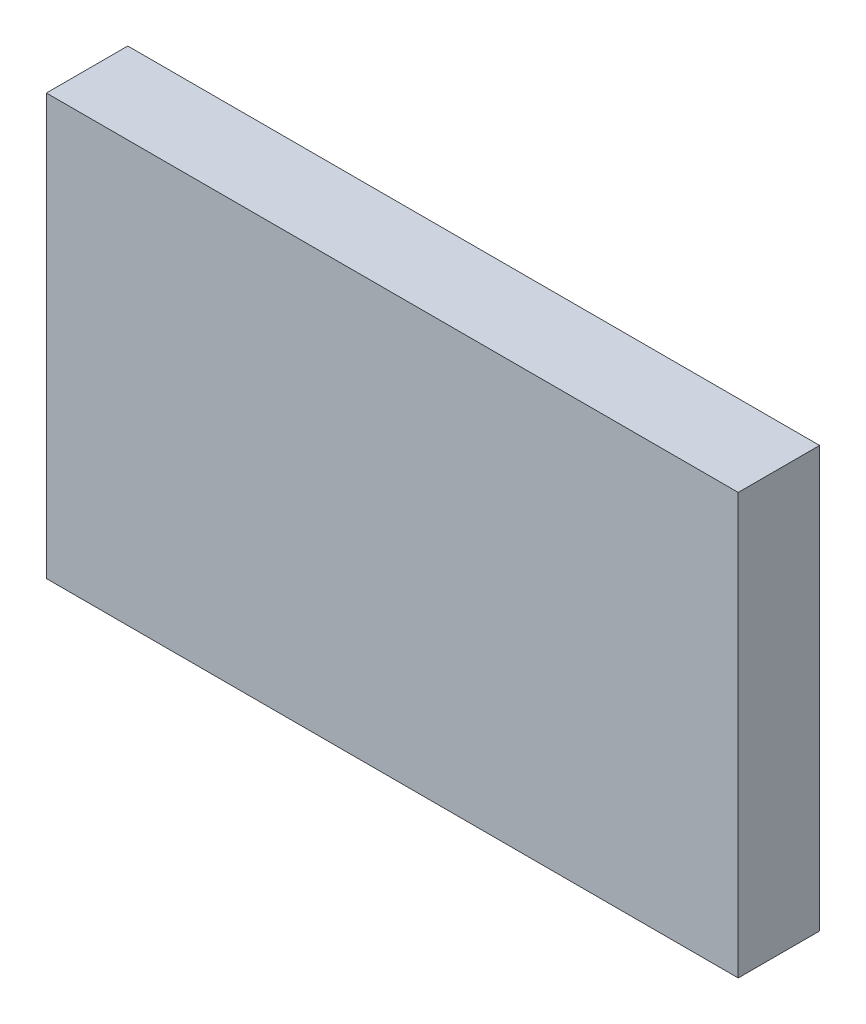
from build123d import *

# Parameters (mm, degrees)
SKETCH_1_W      = 102
SKETCH_1_H      = 62
EXTRUDE_1_DEPTH = 12


with BuildPart() as part:
    # 草图1 → 凸台-拉伸1 (new body)
    with BuildSketch(Plane.XY):
        with Locations((51, -31)):
            Rectangle(SKETCH_1_W, SKETCH_1_H)
    extrude(amount=EXTRUDE_1_DEPTH)


solid = part.part
